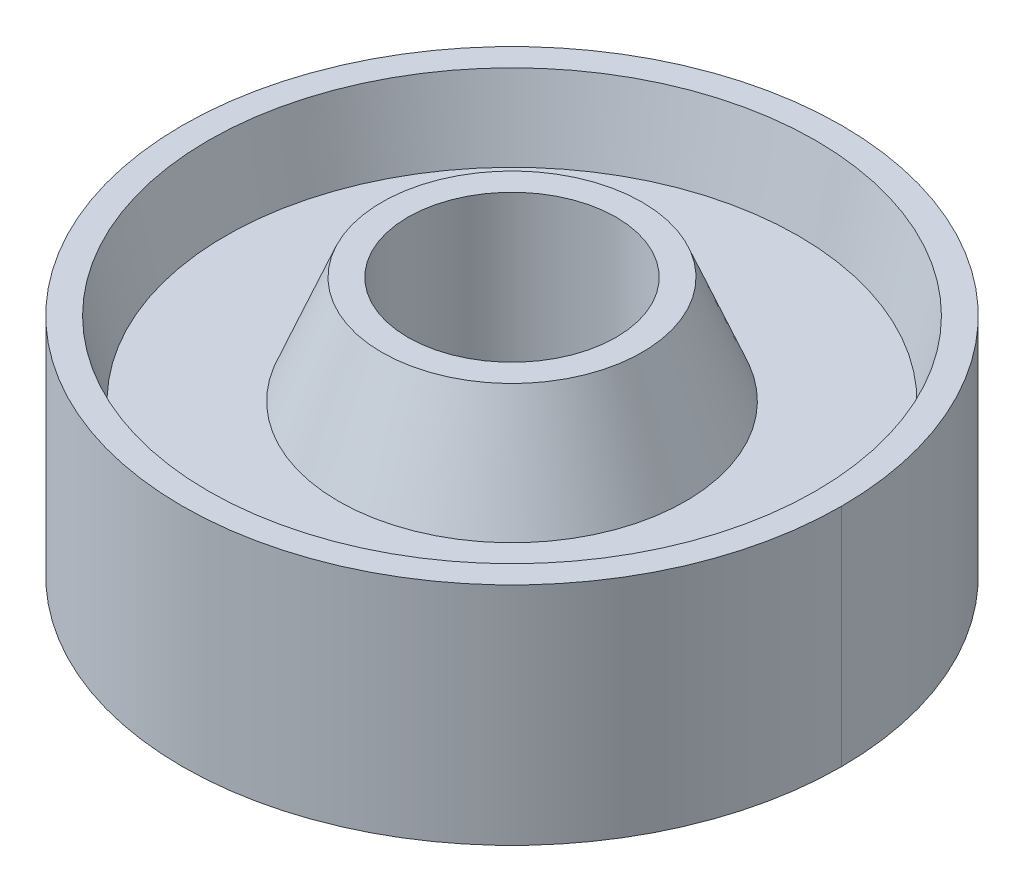
from build123d import *

# Parameters (mm, degrees)
CORTAR_EXTRUIR1_REACH = 70.338
CROQUIS2_R            = 12


with BuildPart() as part:
    # Croquis1 → Revolución1 (revolve)
    with BuildSketch(Plane.XY, mode=Mode.PRIVATE) as revoluci_n1_sk:
        Polygon((7.730917784, 46.314331723), (7.730917784, 12.628663446), (22.730917784, 12.628663446), (27.730917784, 24.989291465), (40.730917784, 24.989291465), (42.730917784, 16.471497585), (45.730917784, 16.471497585), (45.730917784, 42.471497585), (42.730917784, 42.471497585), (40.730917784, 33.953703704), (27.730917784, 33.953703704), (22.730917784, 46.314331723), align=None)
    revolve(revoluci_n1_sk.sketch.rotate(Axis((7.730917784, 46.314331723, 0), (0, -1, 0)), 90), axis=Axis((7.730917784, 46.314331723, 0), (0, -1, 0)))

    # Croquis2 → Cortar-Extruir1 (cut, up to next)
    with BuildSketch(Plane(origin=(0, 46.314331723, 0), x_dir=(1, 0, 0), z_dir=(0, 1, 0)), mode=Mode.PRIVATE) as cortar_extruir1_sk1:
        with Locations(Location((7.730917784, 0, 0), (0, 0, 270))):
            Circle(CROQUIS2_R)
    cortar_extruir1_tool1 = extrude(cortar_extruir1_sk1.sketch, amount=-CORTAR_EXTRUIR1_REACH, mode=Mode.PRIVATE) & part.part
    add(cortar_extruir1_tool1.solids().sort_by_distance((7.730918, 46.314332, 0))[0], mode=Mode.SUBTRACT)


solid = part.part
